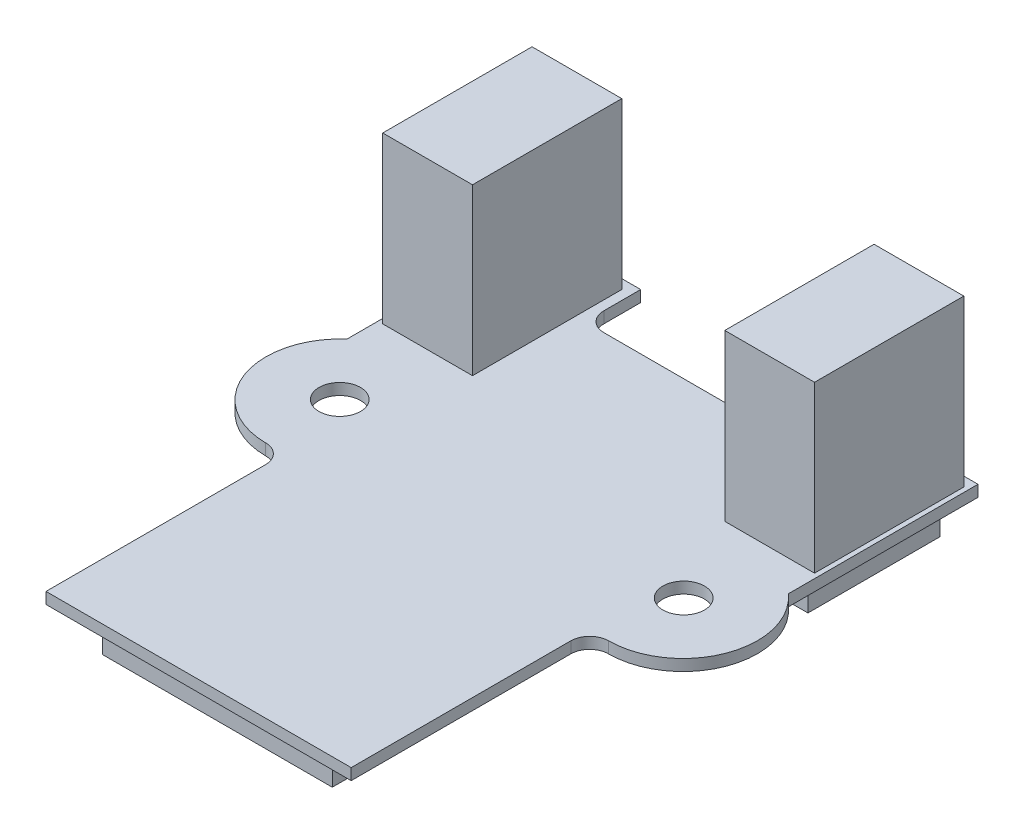
from build123d import *

# Parameters (mm, degrees)
BOSS_EXTRUDE1_DEPTH = 0.6
SKETCH2_R           = 1.1
CUT_EXTRUDE1_DEPTH  = 22.075696904
SKETCH3_W           = 12.15
SKETCH3_H           = 10.57
SKETCH3_W_2         = 2
SKETCH3_H_2         = 7
BOSS_EXTRUDE2_DEPTH = 1.8
SKETCH4_W           = 4.75
SKETCH4_H           = 7.9
BOSS_EXTRUDE3_DEPTH = 8.75
FILLET1_R           = 1


with BuildPart() as part:
    # Sketch1 → Boss-Extrude1 (new body)
    with BuildSketch(Plane(origin=(0, 0, 0), x_dir=(1, 0, 0), z_dir=(0, 1, 0))):
        with BuildLine():
            Line((6.175, 10.05), (-6.175, 10.05))
            Line((-6.175, 10.05), (-6.175, 13))
            Line((-6.175, 13), (-11.675, 13))
            Line((-11.675, 13), (-11.675, 2.960451824))
            ThreePointArc((-11.675, 2.960451824), (-12.549347485, -1.851203428), (-8.075, -3.82521568))
            Line((-8.075, -3.82521568), (-8.075, -16.57))
            Line((-8.075, -16.57), (8.075, -16.57))
            Line((8.075, -16.57), (8.075, -3.82521568))
            ThreePointArc((8.075, -3.82521568), (12.549347485, -1.851203428), (11.675, 2.960451824))
            Line((11.675, 2.960451824), (11.675, 13))
            Line((11.675, 13), (6.175, 13))
            Line((6.175, 13), (6.175, 10.05))
        make_face()
    extrude(amount=BOSS_EXTRUDE1_DEPTH)

    # Sketch2 → Cut-Extrude1 (cut, through all)
    with BuildSketch(Plane(origin=(0, 0.6, 0), x_dir=(1, 0, 0), z_dir=(0, 1, 0))):
        with Locations(Location((-9.1, 0, 0), (0, 0, 270))):
            Circle(SKETCH2_R)
        with Locations(Location((9.1, 0, 0), (0, 0, 90))):
            Circle(SKETCH2_R)
    extrude(amount=-CUT_EXTRUDE1_DEPTH, mode=Mode.SUBTRACT)

    # Sketch3 → Boss-Extrude2 (add)
    with BuildSketch(Plane.XZ):
        with Locations((0, 10.285)):
            Rectangle(SKETCH3_W, SKETCH3_H)
        with Locations((-9.675, -8.5)):
            Rectangle(SKETCH3_W_2, SKETCH3_H_2)
        with Locations((9.675, -8.5)):
            Rectangle(SKETCH3_W_2, SKETCH3_H_2)
    extrude(amount=BOSS_EXTRUDE2_DEPTH)

    # Sketch4 → Boss-Extrude3 (add)
    with BuildSketch(Plane(origin=(0, 0.6, 0), x_dir=(1, 0, 0), z_dir=(0, 1, 0))):
        with Locations((-9.05, 8.55)):
            Rectangle(SKETCH4_W, SKETCH4_H)
        with Locations((9.05, 8.55)):
            Rectangle(SKETCH4_W, SKETCH4_H)
    extrude(amount=BOSS_EXTRUDE3_DEPTH)

    # Fillet1
    fillet1_edges = [part.edges().sort_by_distance(p)[0] for p in [
        (-6.175, 0.3, -10.05),
        (6.175, 0.3, -10.05),
        (8.075, 0.3, 3.82521568),
        (-8.075, 0.3, 3.82521568),
    ]]
    fillet(fillet1_edges, radius=FILLET1_R)


solid = part.part
